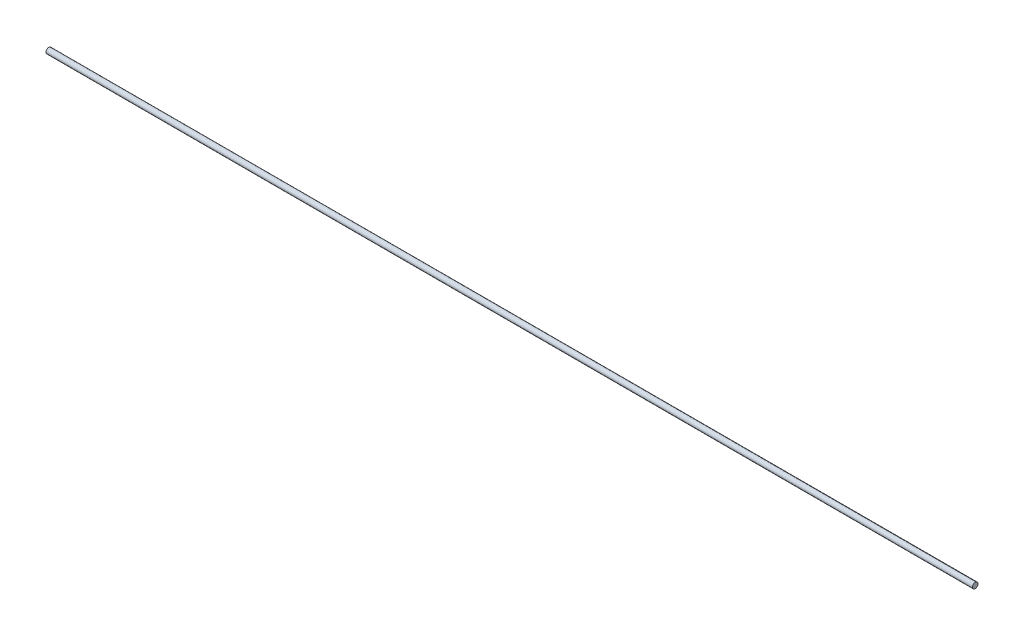
from build123d import *

# Parameters (mm, degrees)
SKETCH_1_R      = 6
EXTRUDE_1_DEPTH = 2000


with BuildPart() as part:
    # Эскиз1 → Бобышка-Вытянуть1 (new body)
    with BuildSketch(Plane(origin=(0, 0, 0), x_dir=(0, 0, -1), z_dir=(1, 0, 0))):
        Circle(SKETCH_1_R)
    extrude(amount=EXTRUDE_1_DEPTH)


solid = part.part
